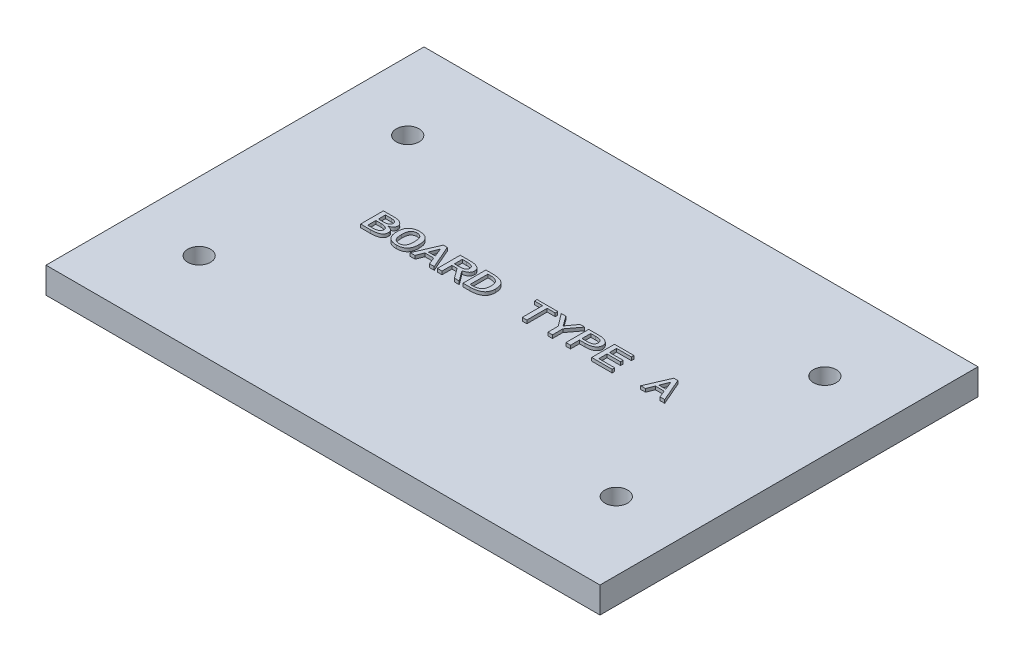
from build123d import *

# Parameters (mm, degrees)
SKETCH_1_W      = 85
SKETCH_1_H      = 58
SKETCH_1_R      = 1.75
EXTRUDE_1_DEPTH = 4
EXTRUDE_2_DEPTH = 0.5


with BuildPart() as part:
    # 草图1 → 凸台-拉伸1 (new body)
    with BuildSketch(Plane(origin=(0, 0, 0), x_dir=(1, 0, 0), z_dir=(0, 1, 0))):
        Rectangle(SKETCH_1_W, SKETCH_1_H)
        with Locations(Location((-32, 16, 0), (0, 0, 270))):
            Circle(SKETCH_1_R, mode=Mode.SUBTRACT)
        with Locations(Location((32, 16, 0), (0, 0, 270))):
            Circle(SKETCH_1_R, mode=Mode.SUBTRACT)
        with Locations(Location((-32, -16, 0), (0, 0, 270))):
            Circle(SKETCH_1_R, mode=Mode.SUBTRACT)
        with Locations(Location((32, -16, 0), (0, 0, 270))):
            Circle(SKETCH_1_R, mode=Mode.SUBTRACT)
    extrude(amount=EXTRUDE_1_DEPTH)

    # 草图2 → 凸台-拉伸2 (add)
    # profile 1 of 10: a face of its own
    with BuildSketch(Plane(origin=(0, 4, 0), x_dir=(1, 0, 0), z_dir=(0, 1, 0))):
        with BuildLine():
            Line((-21.797692174, 0.102339181), (-23.332779893, 0.102339181))
            Line((-23.332779893, 0.102339181), (-23.332779893, 3.602339181))
            Line((-23.332779893, 3.602339181), (-21.736288665, 3.602339181))
            add(Edge.make_bspline(
                [(-21.736288665, 3.602339181), (-21.616284104, 3.603473702), (-21.441873847, 3.59465269), (-21.21789749, 3.567721016), (-21.067792579, 3.538014015), (-20.929535241, 3.501126297), (-20.802923191, 3.455900128), (-20.688343644, 3.401571651), (-20.586101754, 3.338964298), (-20.496202876, 3.270837989), (-20.417522999, 3.199533349), (-20.350526134, 3.124985367), (-20.296821602, 3.046368302), (-20.252971764, 2.965575829), (-20.213740965, 2.851578615), (-20.200889294, 2.761963501), (-20.201200946, 2.701754386)],
                knots=[0, 0, 0, 0, 0.182524265, 0.265463842, 0.343061599, 0.415164942, 0.483036758, 0.547361978, 0.607769525, 0.665140331, 0.718759811, 0.769149503, 0.817252905, 0.863350389, 0.908589915, 1, 1, 1, 1], degree=3))
            add(Edge.make_bspline(
                [(-20.201200946, 2.701754386), (-20.200467821, 2.644043768), (-20.208404521, 2.559648697), (-20.236810838, 2.453582491), (-20.264139364, 2.381575778), (-20.302412925, 2.316750336), (-20.346843791, 2.256901092), (-20.401006691, 2.204106282), (-20.482510467, 2.14292414), (-20.591753837, 2.078617264), (-20.76739737, 1.990465869), (-20.906226805, 1.945112425), (-20.99944656, 1.923976608)],
                knots=[0, 0, 0, 0, 0.142117251, 0.207165661, 0.270019687, 0.331064607, 0.391915799, 0.453071598, 0.51653855, 0.642452766, 0.764607591, 1, 1, 1, 1], degree=3))
            add(Edge.make_bspline(
                [(-20.99944656, 1.923976608), (-20.879942895, 1.905156722), (-20.705981895, 1.857472394), (-20.488708342, 1.760283885), (-20.363598011, 1.686140579), (-20.271888156, 1.619158712), (-20.212109292, 1.564005009), (-20.160962272, 1.505084286), (-20.119417576, 1.44129545), (-20.087464199, 1.373398011), (-20.056331113, 1.275891685), (-20.048116331, 1.198410556), (-20.048071208, 1.14619883)],
                knots=[0, 0, 0, 0, 0.271119313, 0.402277235, 0.532922221, 0.596517756, 0.656684212, 0.714965633, 0.771090433, 0.826870731, 0.882797701, 1, 1, 1, 1], degree=3))
            add(Edge.make_bspline(
                [(-20.048071208, 1.14619883), (-20.048335297, 1.054429592), (-20.060291339, 0.919687442), (-20.113422525, 0.75326374), (-20.168040603, 0.643935439), (-20.237398387, 0.545804668), (-20.323110347, 0.459737341), (-20.424368052, 0.385814362), (-20.540546406, 0.324520059), (-20.667717721, 0.272338722), (-20.803846295, 0.226936793), (-20.948410926, 0.188325759), (-21.101498875, 0.15650255), (-21.263531435, 0.132579468), (-21.496154775, 0.108991817), (-21.675535981, 0.102609916), (-21.797692174, 0.102339181)],
                knots=[0, 0, 0, 0, 0.119735924, 0.174372551, 0.226617972, 0.278300702, 0.330192547, 0.384098844, 0.440933986, 0.500827015, 0.562953935, 0.627692933, 0.695589296, 0.766470504, 0.840899932, 1, 1, 1, 1], degree=3))
        make_face()
        with BuildLine():
            Line((-21.705965945, 3.213450292), (-22.627018576, 3.213450292))
            Line((-22.627018576, 3.213450292), (-22.627018576, 2.128654971))
            Line((-22.627018576, 2.128654971), (-21.736288665, 2.128654971))
            add(Edge.make_bspline(
                [(-21.736288665, 2.128654971), (-21.630758006, 2.128520977), (-21.476064443, 2.143194272), (-21.282416552, 2.199523068), (-21.173551309, 2.247386715), (-21.095969116, 2.295977521), (-21.044780773, 2.336827722), (-21.003004988, 2.384894082), (-20.967409443, 2.437201102), (-20.941009489, 2.496127292), (-20.913657364, 2.583400846), (-20.907941865, 2.654040306), (-20.907720331, 2.701754386)],
                knots=[0, 0, 0, 0, 0.278970215, 0.406954108, 0.531510838, 0.591504086, 0.648418678, 0.703733746, 0.759081016, 0.814925044, 0.873612139, 1, 1, 1, 1], degree=3))
            add(Edge.make_bspline(
                [(-20.907720331, 2.701754386), (-20.908255987, 2.743411161), (-20.913658825, 2.805113146), (-20.938942918, 2.881382785), (-20.963963914, 2.932994419), (-20.997070972, 2.979526608), (-21.037208364, 3.021755973), (-21.084187875, 3.059796915), (-21.157885116, 3.103177157), (-21.261038887, 3.148412007), (-21.449815479, 3.201507837), (-21.601897933, 3.213173996), (-21.705965945, 3.213450292)],
                knots=[0, 0, 0, 0, 0.117826479, 0.172575393, 0.225786809, 0.278960054, 0.332886894, 0.389634448, 0.448773611, 0.573488133, 0.706095314, 1, 1, 1, 1], degree=3))
        make_face(mode=Mode.SUBTRACT)
        with BuildLine():
            Line((-21.828772962, 1.739766082), (-22.627018576, 1.739766082))
            Line((-22.627018576, 1.739766082), (-22.627018576, 0.49122807))
            Line((-22.627018576, 0.49122807), (-21.920499191, 0.49122807))
            add(Edge.make_bspline(
                [(-21.920499191, 0.49122807), (-21.833791474, 0.49141216), (-21.707576052, 0.49475523), (-21.545275814, 0.510866619), (-21.43548509, 0.525046143), (-21.33421846, 0.54619562), (-21.240426659, 0.569690034), (-21.155202018, 0.599400343), (-21.077497667, 0.632369948), (-21.008559327, 0.671695999), (-20.948412124, 0.718527978), (-20.897430667, 0.772392433), (-20.85560525, 0.833479656), (-20.82362053, 0.901871414), (-20.792700989, 1.005734293), (-20.784760675, 1.089211026), (-20.784913313, 1.14619883)],
                knots=[0, 0, 0, 0, 0.174987899, 0.254371177, 0.328987454, 0.398169657, 0.46295843, 0.523896581, 0.580056805, 0.63304333, 0.683520728, 0.733285223, 0.782066118, 0.832233677, 0.884967024, 1, 1, 1, 1], degree=3))
            add(Edge.make_bspline(
                [(-20.784913313, 1.14619883), (-20.785122065, 1.197245253), (-20.794037002, 1.272542875), (-20.828472918, 1.364943328), (-20.863758762, 1.426650267), (-20.90978595, 1.481709569), (-20.966417118, 1.529697932), (-21.032172467, 1.572709965), (-21.134608309, 1.620097469), (-21.273607077, 1.667853013), (-21.513405619, 1.725077133), (-21.701392981, 1.739566711), (-21.828772962, 1.739766082)],
                knots=[0, 0, 0, 0, 0.114530706, 0.167740019, 0.219985816, 0.273047338, 0.32763925, 0.385740966, 0.44854054, 0.579968457, 0.71440557, 1, 1, 1, 1], degree=3))
        make_face(mode=Mode.SUBTRACT)
    # profile 2 of 10: a face of its own
    with BuildSketch(Plane(origin=(0, 4, 0), x_dir=(1, 0, 0), z_dir=(0, 1, 0))):
        Polygon((-12.034534279, 0.102339181), (-12.771376384, 0.102339181), (-13.201200946, 1.187134503), (-14.552078139, 1.187134503), (-14.9819027, 0.102339181), (-15.718744805, 0.102339181), (-14.183657086, 3.643274854), (-13.569621998, 3.643274854), align=None)
        Polygon((-13.355088752, 1.576023392), (-13.846316822, 2.824561404), (-13.907720331, 2.824561404), (-14.398948401, 1.576023392), align=None, mode=Mode.SUBTRACT)
    # profile 3 of 10: a face of its own
    with BuildSketch(Plane(origin=(0, 4, 0), x_dir=(1, 0, 0), z_dir=(0, 1, 0))):
        with BuildLine():
            Line((-8.197194015, 0.102339181), (-8.93403612, 0.102339181))
            Line((-8.93403612, 0.102339181), (-10.039299278, 1.616959064))
            Line((-10.039299278, 1.616959064), (-10.837544892, 1.616959064))
            Line((-10.837544892, 1.616959064), (-10.837544892, 0.102339181))
            Line((-10.837544892, 0.102339181), (-11.543306209, 0.102339181))
            Line((-11.543306209, 0.102339181), (-11.543306209, 3.602339181))
            Line((-11.543306209, 3.602339181), (-10.00821849, 3.602339181))
            add(Edge.make_bspline(
                [(-10.00821849, 3.602339181), (-9.891166868, 3.60148649), (-9.719128771, 3.59680248), (-9.496722037, 3.570613616), (-9.342609844, 3.545012058), (-9.196803834, 3.512793897), (-9.05994421, 3.47173231), (-8.931259547, 3.424256868), (-8.811985789, 3.369169825), (-8.703577319, 3.306576112), (-8.608422331, 3.233751586), (-8.528461635, 3.150918877), (-8.462935031, 3.058322277), (-8.411728579, 2.956998038), (-8.362980664, 2.804789355), (-8.349495513, 2.682796658), (-8.350323753, 2.599415205)],
                knots=[0, 0, 0, 0, 0.161275904, 0.236591985, 0.308212348, 0.37633669, 0.442061158, 0.504820003, 0.565066839, 0.622775199, 0.676854049, 0.729517285, 0.780686761, 0.832506366, 0.885214416, 1, 1, 1, 1], degree=3))
            add(Edge.make_bspline(
                [(-8.350323753, 2.599415205), (-8.350178347, 2.534638492), (-8.358334868, 2.43900889), (-8.391597157, 2.3185045), (-8.425121081, 2.235648806), (-8.468455624, 2.158510539), (-8.522353829, 2.087746979), (-8.584667097, 2.021798015), (-8.657095693, 1.963606869), (-8.734817053, 1.910357037), (-8.816020708, 1.861578797), (-8.900401936, 1.818722902), (-8.987110713, 1.779407243), (-9.07718241, 1.746464108), (-9.20198778, 1.708398848), (-9.298619796, 1.688999482), (-9.363860682, 1.678362573)],
                knots=[0, 0, 0, 0, 0.129380057, 0.190056645, 0.248860571, 0.307339311, 0.366032876, 0.425950449, 0.4879309, 0.551011241, 0.613879616, 0.676798523, 0.739771961, 0.80374682, 0.86803093, 1, 1, 1, 1], degree=3))
            Line((-9.363860682, 1.678362573), (-8.197194015, 0.102339181))
        make_face()
        with BuildLine():
            Line((-10.162106296, 3.213450292), (-10.837544892, 3.213450292))
            Line((-10.837544892, 3.213450292), (-10.837544892, 2.005847953))
            Line((-10.837544892, 2.005847953), (-9.977895769, 2.005847953))
            add(Edge.make_bspline(
                [(-9.977895769, 2.005847953), (-9.86204028, 2.005786313), (-9.692338321, 2.020543559), (-9.478033738, 2.076575576), (-9.356839888, 2.124808331), (-9.268612081, 2.172592525), (-9.211707771, 2.215352806), (-9.164137797, 2.264830796), (-9.124110149, 2.319572765), (-9.093523108, 2.381106047), (-9.064585401, 2.473930149), (-9.057029239, 2.548494533), (-9.056843138, 2.599415205)],
                knots=[0, 0, 0, 0, 0.281863478, 0.411533338, 0.537506338, 0.598024929, 0.655048572, 0.709802236, 0.764376313, 0.819336466, 0.876081327, 1, 1, 1, 1], degree=3))
            add(Edge.make_bspline(
                [(-9.056843138, 2.599415205), (-9.056553214, 2.645028788), (-9.063871335, 2.712760937), (-9.091753636, 2.797745593), (-9.120717018, 2.856376539), (-9.15791176, 2.91099424), (-9.202621844, 2.962089092), (-9.256788313, 3.00833031), (-9.318304045, 3.051937151), (-9.389454576, 3.090712249), (-9.470363196, 3.123851899), (-9.560980075, 3.151745726), (-9.661689546, 3.174097482), (-9.772513103, 3.192304389), (-9.940297782, 3.209617498), (-10.071569603, 3.213727451), (-10.162106296, 3.213450292)],
                knots=[0, 0, 0, 0, 0.096695759, 0.142919783, 0.188895054, 0.234782944, 0.282583324, 0.332297588, 0.385329427, 0.442120287, 0.503571159, 0.570296056, 0.642775079, 0.721996916, 0.808147817, 1, 1, 1, 1], degree=3))
        make_face(mode=Mode.SUBTRACT)
    # profile 4 of 10: a face of its own
    with BuildSketch(Plane(origin=(0, 4, 0), x_dir=(1, 0, 0), z_dir=(0, 1, 0))):
        with BuildLine():
            Line((-6.569621998, 0.102339181), (-7.613481648, 0.102339181))
            Line((-7.613481648, 0.102339181), (-7.613481648, 3.602339181))
            Line((-7.613481648, 3.602339181), (-6.569621998, 3.602339181))
            add(Edge.make_bspline(
                [(-6.569621998, 3.602339181), (-6.478137887, 3.602033915), (-6.343022003, 3.600130155), (-6.166203942, 3.588545958), (-6.040555805, 3.577357494), (-5.919472466, 3.56287574), (-5.803162791, 3.545578544), (-5.691295897, 3.525348171), (-5.584430496, 3.500865072), (-5.4821694, 3.473889675), (-5.384673268, 3.443171715), (-5.291463291, 3.410503772), (-5.203615922, 3.372744455), (-5.119692018, 3.333708857), (-5.040656751, 3.290450366), (-4.966667906, 3.243228053), (-4.896328709, 3.194055205), (-4.830691568, 3.140884632), (-4.770194223, 3.082819268), (-4.712821358, 3.021583373), (-4.66083241, 2.95516634), (-4.611786072, 2.885478326), (-4.568187762, 2.810833426), (-4.527817992, 2.732816834), (-4.49181201, 2.65036188), (-4.461406383, 2.563443292), (-4.433802921, 2.472714509), (-4.410252031, 2.377885005), (-4.391411205, 2.278662514), (-4.377314166, 2.175388363), (-4.362515502, 2.029719628), (-4.359671782, 1.917941633), (-4.359095683, 1.842105263)],
                knots=[0, 0, 0, 0, 0.0842054, 0.124283936, 0.163042797, 0.200279654, 0.236487956, 0.27124311, 0.304865002, 0.337354882, 0.368539485, 0.398916858, 0.428199319, 0.456492815, 0.48407108, 0.511037663, 0.537232202, 0.563017906, 0.588677477, 0.614347583, 0.640168913, 0.666229962, 0.692710912, 0.7196474, 0.747036784, 0.775427583, 0.804338354, 0.83428636, 0.865298819, 0.897231352, 0.930180674, 1, 1, 1, 1], degree=3))
            add(Edge.make_bspline(
                [(-4.359095683, 1.842105263), (-4.359472321, 1.766518293), (-4.362574292, 1.654619279), (-4.379552267, 1.509296623), (-4.394956445, 1.406161419), (-4.416483373, 1.307561159), (-4.442010101, 1.212837614), (-4.47236395, 1.12245106), (-4.507261561, 1.03623048), (-4.547362137, 0.954437379), (-4.592505964, 0.877056063), (-4.640714576, 0.802998211), (-4.694721394, 0.733756655), (-4.75426463, 0.669632167), (-4.817030991, 0.608545154), (-4.885054644, 0.55216975), (-4.982513147, 0.482457995), (-5.114557388, 0.40459159), (-5.284294278, 0.323375712), (-5.466696535, 0.254008085), (-5.662846593, 0.199471462), (-5.871148257, 0.155297877), (-6.174279163, 0.113538444), (-6.409120188, 0.101870367), (-6.569621998, 0.102339181)],
                knots=[0, 0, 0, 0, 0.070517258, 0.104184654, 0.13637364, 0.16770447, 0.198224895, 0.227803218, 0.256547805, 0.284891792, 0.312654038, 0.340033755, 0.367227334, 0.394407642, 0.421567519, 0.448837538, 0.476691606, 0.533219254, 0.591493853, 0.651966886, 0.714912264, 0.781128572, 0.850366331, 1, 1, 1, 1], degree=3))
        make_face()
        with BuildLine():
            Line((-6.569621998, 3.213450292), (-6.907720331, 3.213450292))
            Line((-6.907720331, 3.213450292), (-6.907720331, 0.49122807))
            Line((-6.907720331, 0.49122807), (-6.569621998, 0.49122807))
            add(Edge.make_bspline(
                [(-6.569621998, 0.49122807), (-6.454271349, 0.491681048), (-6.286128595, 0.498201803), (-6.071333503, 0.530611239), (-5.926985498, 0.562722085), (-5.794079442, 0.604580912), (-5.672442274, 0.654935946), (-5.562128094, 0.715076103), (-5.463133013, 0.785239081), (-5.374701931, 0.867379499), (-5.299558637, 0.964684596), (-5.236281031, 1.076454527), (-5.184082651, 1.201914623), (-5.144376094, 1.341930248), (-5.10446323, 1.555671825), (-5.097194864, 1.725216433), (-5.095937788, 1.842105263)],
                knots=[0, 0, 0, 0, 0.149275686, 0.217027123, 0.280685441, 0.340318026, 0.397001814, 0.450674314, 0.502451102, 0.553542762, 0.606163417, 0.660760071, 0.719203402, 0.78146157, 0.848628898, 1, 1, 1, 1], degree=3))
            add(Edge.make_bspline(
                [(-5.095937788, 1.842105263), (-5.097085862, 1.959006411), (-5.104680054, 2.129014996), (-5.144415027, 2.343762209), (-5.183905162, 2.485124812), (-5.2365044, 2.611647179), (-5.299443149, 2.724858498), (-5.375147041, 2.823592021), (-5.462729893, 2.908815004), (-5.562056604, 2.981194973), (-5.672319697, 3.043660664), (-5.793848877, 3.096427369), (-5.926830776, 3.139834426), (-6.071315289, 3.172529678), (-6.286048544, 3.206015208), (-6.45423225, 3.213459155), (-6.569621998, 3.213450292)],
                knots=[0, 0, 0, 0, 0.150565579, 0.218014458, 0.280566001, 0.338998336, 0.393869593, 0.446724446, 0.498442698, 0.550516203, 0.604378887, 0.661144801, 0.720659209, 0.784051309, 0.851491571, 1, 1, 1, 1], degree=3))
        make_face(mode=Mode.SUBTRACT)
    # profile 5 of 10: a face of its own
    with BuildSketch(Plane(origin=(0, 4, 0), x_dir=(1, 0, 0), z_dir=(0, 1, 0))):
        Polygon((3.408069143, 3.213450292), (2.179998968, 3.213450292), (2.179998968, 0.102339181), (1.474237651, 0.102339181), (1.474237651, 3.213450292), (0.246167475, 3.213450292), (0.246167475, 3.602339181), (3.408069143, 3.602339181), align=None)
    # profile 6 of 10: a face of its own
    with BuildSketch(Plane(origin=(0, 4, 0), x_dir=(1, 0, 0), z_dir=(0, 1, 0))):
        Polygon((7.553185019, 3.602339181), (6.109823529, 1.678362573), (6.109823529, 0.102339181), (5.404062212, 0.102339181), (5.404062212, 1.678362573), (3.960700722, 3.602339181), (4.667220107, 3.602339181), (5.741402476, 2.108187135), (5.772483265, 2.108187135), (6.846665634, 3.602339181), align=None)
    # profile 7 of 10: a face of its own
    with BuildSketch(Plane(origin=(0, 4, 0), x_dir=(1, 0, 0), z_dir=(0, 1, 0))):
        with BuildLine():
            Line((9.763711335, 1.473684211), (8.872981424, 1.473684211))
            Line((8.872981424, 1.473684211), (8.872981424, 0.102339181))
            Line((8.872981424, 0.102339181), (8.167220107, 0.102339181))
            Line((8.167220107, 0.102339181), (8.167220107, 3.602339181))
            Line((8.167220107, 3.602339181), (9.763711335, 3.602339181))
            add(Edge.make_bspline(
                [(9.763711335, 3.602339181), (9.884692978, 3.602553197), (10.061330815, 3.59407163), (10.288875079, 3.56428187), (10.44441502, 3.533920134), (10.589133647, 3.492453397), (10.723450039, 3.443672399), (10.847625859, 3.385935036), (10.960228169, 3.318627222), (11.061299935, 3.243920277), (11.149159183, 3.162199885), (11.224627327, 3.074959944), (11.284967094, 2.979644522), (11.332123145, 2.87818193), (11.37918524, 2.732401639), (11.389841377, 2.616040912), (11.390525283, 2.538011696)],
                knots=[0, 0, 0, 0, 0.166726734, 0.243311705, 0.316114574, 0.384900459, 0.450563682, 0.512878112, 0.573317472, 0.63105595, 0.685757262, 0.738373695, 0.789574368, 0.840675466, 0.892217257, 1, 1, 1, 1], degree=3))
            add(Edge.make_bspline(
                [(11.390525283, 2.538011696), (11.389897457, 2.459954205), (11.379079194, 2.343675219), (11.332344331, 2.197984027), (11.284523888, 2.096877834), (11.224915333, 2.001136485), (11.149117397, 1.913848808), (11.061312298, 1.832094692), (10.960223409, 1.757403112), (10.847631968, 1.690068457), (10.72342953, 1.632427298), (10.589279653, 1.583286607), (10.444171916, 1.543357255), (10.289003823, 1.511388763), (10.061272041, 1.482219023), (9.884724931, 1.473324894), (9.763711335, 1.473684211)],
                knots=[0, 0, 0, 0, 0.107787774, 0.15933197, 0.210120021, 0.261617137, 0.314236025, 0.36893989, 0.426681063, 0.487123244, 0.549440582, 0.615106869, 0.683801574, 0.756676939, 0.833265485, 1, 1, 1, 1], degree=3))
        make_face()
        with BuildLine():
            Line((9.579500809, 3.213450292), (8.872981424, 3.213450292))
            Line((8.872981424, 3.213450292), (8.872981424, 1.862573099))
            Line((8.872981424, 1.862573099), (9.579500809, 1.862573099))
            add(Edge.make_bspline(
                [(9.579500809, 1.862573099), (9.665953174, 1.86277483), (9.791422541, 1.866008246), (9.952455068, 1.882201547), (10.060729435, 1.896408174), (10.160026071, 1.917344417), (10.251073498, 1.940886451), (10.332935058, 1.970859695), (10.407378778, 2.003772998), (10.473852408, 2.042985718), (10.530288964, 2.0913416), (10.578278208, 2.147102993), (10.617922698, 2.210348696), (10.64835433, 2.281739895), (10.677253614, 2.390835011), (10.684550634, 2.478059539), (10.684763967, 2.538011696)],
                knots=[0, 0, 0, 0, 0.175096659, 0.25374268, 0.327609731, 0.396034496, 0.459074399, 0.517816329, 0.572305525, 0.623718037, 0.673435519, 0.72204309, 0.772148586, 0.823938941, 0.878543285, 1, 1, 1, 1], degree=3))
            add(Edge.make_bspline(
                [(10.684763967, 2.538011696), (10.684550634, 2.597963853), (10.677253614, 2.685188381), (10.64835433, 2.794283497), (10.617922698, 2.865674696), (10.578278208, 2.928920399), (10.530288964, 2.984681792), (10.473852408, 3.033037673), (10.407378778, 3.072250394), (10.332935058, 3.105163697), (10.251073498, 3.135136941), (10.160026071, 3.158678975), (10.060729435, 3.179615218), (9.952455068, 3.193821845), (9.791422541, 3.210015146), (9.665953174, 3.213248561), (9.579500809, 3.213450292)],
                knots=[0, 0, 0, 0, 0.121456715, 0.176061059, 0.227851414, 0.27795691, 0.326564481, 0.376281963, 0.427694475, 0.482183671, 0.540925601, 0.603965504, 0.672390269, 0.74625732, 0.824903341, 1, 1, 1, 1], degree=3))
        make_face(mode=Mode.SUBTRACT)
    # profile 8 of 10: a face of its own
    with BuildSketch(Plane(origin=(0, 4, 0), x_dir=(1, 0, 0), z_dir=(0, 1, 0))):
        Polygon((15.258946336, 0.102339181), (12.127367389, 0.102339181), (12.127367389, 3.602339181), (15.105816598, 3.602339181), (15.105816598, 3.213450292), (12.833886774, 3.213450292), (12.833886774, 2.128654971), (14.921606072, 2.128654971), (14.921606072, 1.739766082), (12.833886774, 1.739766082), (12.833886774, 0.49122807), (15.258946336, 0.49122807), align=None)
    # profile 9 of 10: a face of its own
    with BuildSketch(Plane(origin=(0, 4, 0), x_dir=(1, 0, 0), z_dir=(0, 1, 0))):
        Polygon((23.333886774, 0.102339181), (22.597044668, 0.102339181), (22.167220107, 1.187134503), (20.816342914, 1.187134503), (20.386518352, 0.102339181), (19.649676247, 0.102339181), (21.184763967, 3.643274854), (21.798799054, 3.643274854), align=None)
        Polygon((22.013332301, 1.576023392), (21.522104231, 2.824561404), (21.460700722, 2.824561404), (20.969472652, 1.576023392), align=None, mode=Mode.SUBTRACT)
    # profile 10 of 10: a face of its own
    with BuildSketch(Plane(origin=(0, 4, 0), x_dir=(1, 0, 0), z_dir=(0, 1, 0))):
        with BuildLine():
            add(Edge.make_bspline(
                [(-16.118246646, 1.862573099), (-16.117906975, 1.713139895), (-16.129817677, 1.496388086), (-16.177430288, 1.221199415), (-16.225704434, 1.039139728), (-16.287249203, 0.873414945), (-16.364353922, 0.725124489), (-16.454766723, 0.592979742), (-16.560644223, 0.478703483), (-16.678434784, 0.379487736), (-16.80746646, 0.294355025), (-16.947024776, 0.22215231), (-17.097475831, 0.162454947), (-17.259495764, 0.11763482), (-17.495878546, 0.073146693), (-17.680534233, 0.061678893), (-17.806464104, 0.061403509)],
                knots=[0, 0, 0, 0, 0.158121554, 0.22896709, 0.295107296, 0.357118922, 0.415586013, 0.471496559, 0.525982402, 0.579856262, 0.634053461, 0.689171721, 0.745811146, 0.804965966, 0.866726447, 1, 1, 1, 1], degree=3))
            add(Edge.make_bspline(
                [(-17.806464104, 0.061403509), (-17.932884021, 0.061818266), (-18.11831555, 0.073094609), (-18.355926922, 0.117730944), (-18.519431512, 0.1625599), (-18.672078721, 0.222320774), (-18.81452486, 0.294269447), (-18.946564775, 0.379695465), (-19.068146266, 0.478292586), (-19.176879364, 0.593131059), (-19.271494005, 0.724492014), (-19.350623065, 0.873342429), (-19.414479426, 1.039014503), (-19.465486209, 1.220926205), (-19.513376731, 1.496387331), (-19.526766892, 1.713040719), (-19.525762349, 1.862573099)],
                knots=[0, 0, 0, 0, 0.132825139, 0.194394028, 0.253626612, 0.310592138, 0.366250927, 0.42093911, 0.47543898, 0.530249991, 0.586516527, 0.64492729, 0.706770628, 0.772636831, 0.843010037, 1, 1, 1, 1], degree=3))
            add(Edge.make_bspline(
                [(-19.525762349, 1.862573099), (-19.526011177, 1.939940111), (-19.522928603, 2.053852719), (-19.510700863, 2.202660213), (-19.49765075, 2.307795421), (-19.482077427, 2.408796635), (-19.462226701, 2.505402891), (-19.438983501, 2.597824131), (-19.411485101, 2.685735009), (-19.381429296, 2.769443408), (-19.347124532, 2.848633097), (-19.309243677, 2.923459902), (-19.268319142, 2.994722509), (-19.222799598, 3.061057897), (-19.174211392, 3.123343258), (-19.122631316, 3.18171687), (-19.047203424, 3.251879557), (-18.946677395, 3.332860135), (-18.814188048, 3.415571351), (-18.672065839, 3.486274417), (-18.519220151, 3.544183379), (-18.355922644, 3.588573356), (-18.118163955, 3.631691843), (-17.932967848, 3.644148426), (-17.806464104, 3.643274854)],
                knots=[0, 0, 0, 0, 0.08161252, 0.120129373, 0.157456481, 0.19334739, 0.227901905, 0.26145493, 0.293830021, 0.325029392, 0.355234818, 0.384798312, 0.413463736, 0.44185395, 0.469580713, 0.496764016, 0.523915935, 0.578158244, 0.6326619, 0.688331541, 0.745361685, 0.804789527, 0.866586429, 1, 1, 1, 1], degree=3))
            add(Edge.make_bspline(
                [(-17.806464104, 3.643274854), (-17.680450067, 3.64428785), (-17.496030367, 3.631640386), (-17.259501358, 3.588667105), (-17.09768793, 3.544291141), (-16.947050982, 3.486428997), (-16.807769016, 3.415533828), (-16.678458225, 3.332916303), (-16.561018338, 3.235871375), (-16.454325776, 3.124587305), (-16.364417024, 2.993946617), (-16.287425467, 2.847421458), (-16.225399311, 2.683349923), (-16.177479479, 2.502420585), (-16.129724731, 2.228025948), (-16.117903291, 2.011746237), (-16.118246646, 1.862573099)],
                knots=[0, 0, 0, 0, 0.133901125, 0.195907132, 0.255272198, 0.311986562, 0.36712261, 0.421137686, 0.474752597, 0.528712885, 0.584449518, 0.642719879, 0.704274553, 0.770471212, 0.841390588, 1, 1, 1, 1], degree=3))
        make_face()
        with BuildLine():
            add(Edge.make_bspline(
                [(-16.855088752, 1.862573099), (-16.855425736, 1.993593107), (-16.862038498, 2.181368273), (-16.890935247, 2.418404933), (-16.920619303, 2.569179635), (-16.959842391, 2.701386151), (-17.006045634, 2.815837158), (-17.062115854, 2.911789977), (-17.128750135, 2.988896029), (-17.201890242, 3.050640823), (-17.275909183, 3.106471203), (-17.355237072, 3.15159676), (-17.437950206, 3.189147853), (-17.524356767, 3.219082287), (-17.647158727, 3.246037311), (-17.742099034, 3.25548309), (-17.806464104, 3.254385965)],
                knots=[0, 0, 0, 0, 0.203754382, 0.291659078, 0.371015728, 0.442359699, 0.505760411, 0.562489501, 0.614304638, 0.663309227, 0.711082685, 0.758251432, 0.80484241, 0.852176103, 0.900114036, 1, 1, 1, 1], degree=3))
            add(Edge.make_bspline(
                [(-17.806464104, 3.254385965), (-17.871331071, 3.255475008), (-17.967021765, 3.246049299), (-18.09106816, 3.219011273), (-18.17910627, 3.188837103), (-18.264496574, 3.151699893), (-18.346883594, 3.106287647), (-18.424573765, 3.050962674), (-18.500747012, 2.989001677), (-18.570508781, 2.912048676), (-18.629589818, 2.816051112), (-18.679269144, 2.701842462), (-18.71953587, 2.569212763), (-18.750870744, 2.418484836), (-18.782085801, 2.181519655), (-18.788740814, 1.993598182), (-18.788920244, 1.862573099)],
                knots=[0, 0, 0, 0, 0.099621686, 0.147440688, 0.195018867, 0.24254619, 0.290578069, 0.339435173, 0.38911292, 0.441416894, 0.498369061, 0.561724646, 0.632553809, 0.711243489, 0.798335443, 1, 1, 1, 1], degree=3))
            add(Edge.make_bspline(
                [(-18.788920244, 1.862573099), (-18.788691802, 1.731301184), (-18.782100149, 1.542865066), (-18.750763455, 1.304918543), (-18.719645751, 1.153144092), (-18.679175884, 1.019299077), (-18.629159978, 0.903604602), (-18.570799589, 0.80496795), (-18.5007342, 0.725718521), (-18.424884373, 0.661242559), (-18.346683195, 0.604661958), (-18.264769539, 0.556703713), (-18.179280532, 0.518017198), (-18.091085564, 0.487286664), (-17.967189383, 0.45878176), (-17.871238455, 0.450460566), (-17.806464104, 0.450292398)],
                knots=[0, 0, 0, 0, 0.2006198, 0.287476847, 0.366364026, 0.437059789, 0.500672848, 0.558534069, 0.611333673, 0.661410239, 0.710367365, 0.758631725, 0.806136802, 0.85350209, 0.901068293, 1, 1, 1, 1], degree=3))
            add(Edge.make_bspline(
                [(-17.806464104, 0.450292398), (-17.742192529, 0.450452461), (-17.646989505, 0.458793847), (-17.524338484, 0.487213619), (-17.437765567, 0.51770337), (-17.354961735, 0.556817746), (-17.276106535, 0.604467635), (-17.201586852, 0.661580546), (-17.128766348, 0.725823536), (-17.061838188, 0.805237614), (-17.006465061, 0.903795664), (-16.959931693, 1.019749221), (-16.920514304, 1.153179079), (-16.891036993, 1.304995879), (-16.862023489, 1.543016548), (-16.85547377, 1.731305824), (-16.855088752, 1.862573099)],
                knots=[0, 0, 0, 0, 0.099176275, 0.146853447, 0.193970645, 0.24055053, 0.287971802, 0.335863827, 0.38528907, 0.437620077, 0.495281799, 0.55894235, 0.630141313, 0.709685637, 0.797338097, 1, 1, 1, 1], degree=3))
        make_face(mode=Mode.SUBTRACT)
    extrude(amount=EXTRUDE_2_DEPTH)


solid = part.part
